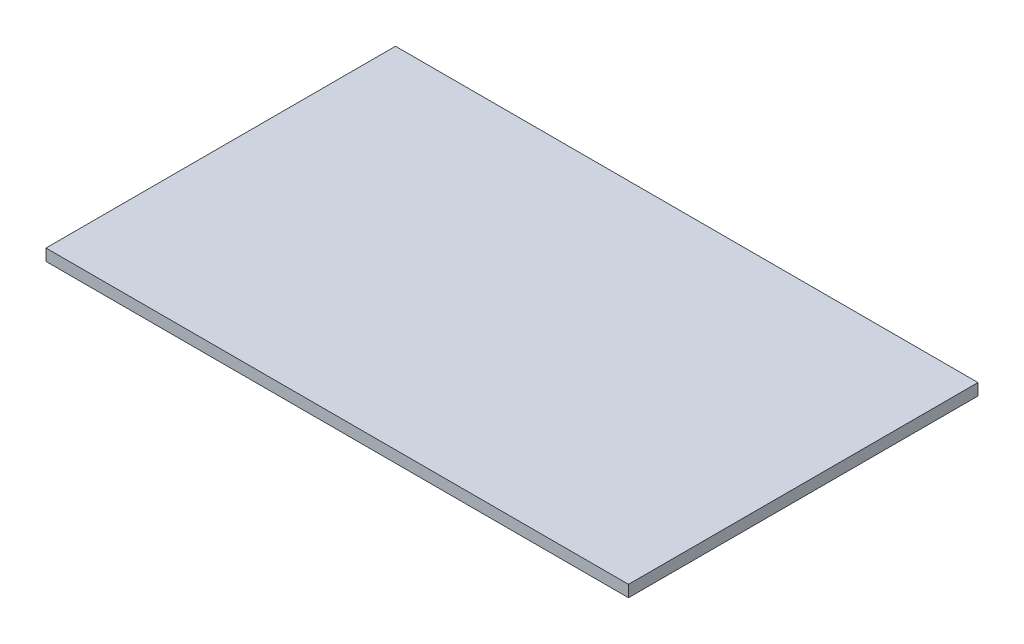
from build123d import *

# Parameters (mm, degrees)
ESQUISSE1_W          = 5000
ESQUISSE1_H          = 3000
BASE_EXTRUSION_DEPTH = 100


with BuildPart() as part:
    # Esquisse1 → Base-Extrusion (new body)
    with BuildSketch(Plane(origin=(0, 0, 0), x_dir=(1, 0, 0), z_dir=(0, 1, 0))):
        with Locations((2500, 1500)):
            Rectangle(ESQUISSE1_W, ESQUISSE1_H)
    extrude(amount=BASE_EXTRUSION_DEPTH)


solid = part.part
